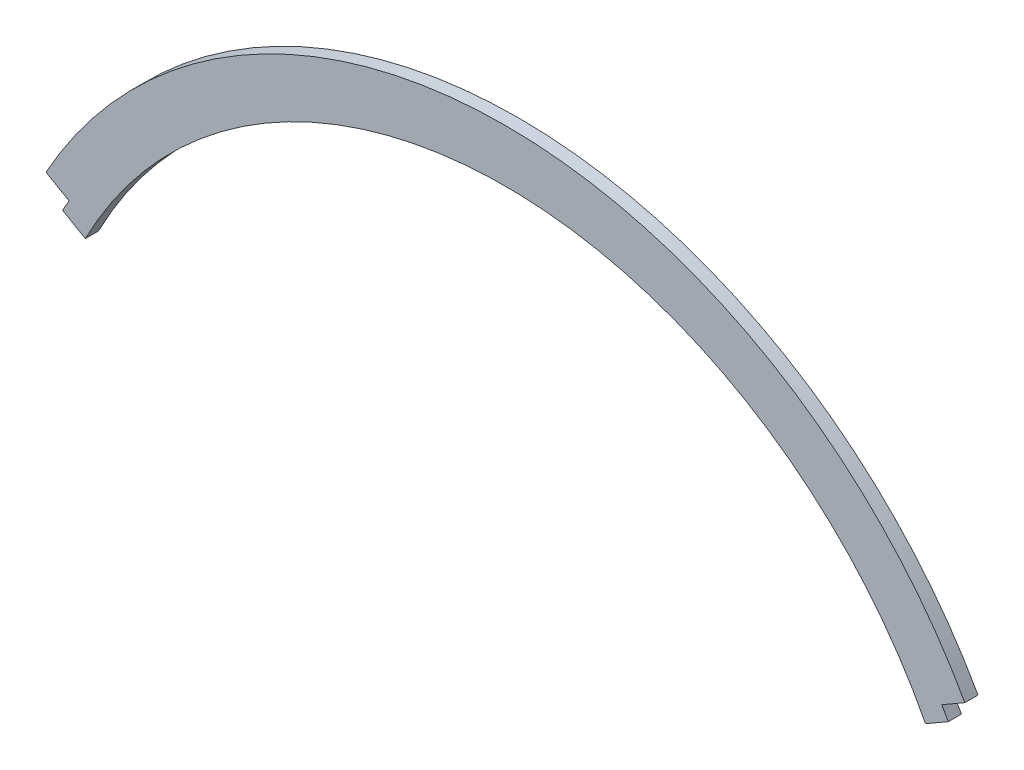
from build123d import *

# Parameters (mm, degrees)
BOSS_EXTRUDE1_DEPTH = 3.175
CUT_EXTRUDE1_DEPTH  = 135.915478092


with BuildPart() as part:
    # Sketch1 → Boss-Extrude1 (new body)
    with BuildSketch(Plane.XY):
        with BuildLine():
            Line((-101.484623167, 0), (-112.493407504, 6.355924601))
            ThreePointArc((-112.493407504, 6.355924601), (0, 74.413297682), (112.493407504, 6.355924601))
            Line((112.493407504, 6.355924601), (101.484623167, 0))
            ThreePointArc((101.484623167, 0), (0, 61.713297682), (-101.484623167, 0))
        make_face()
    extrude(amount=BOSS_EXTRUDE1_DEPTH)

    # Sketch2 → Cut-Extrude1 (cut, symmetric)
    with BuildSketch(Plane.XY.offset(3.175)):
        with BuildLine():
            Line((112.493407504, 6.355924601), (106.989015336, 3.1779623))
            Line((106.989015336, 3.1779623), (105.401515336, 5.927592957))
            Line((105.401515336, 5.927592957), (110.984177534, 9.15074448))
            ThreePointArc((110.984177534, 9.15074448), (111.747530211, 7.758052979), (112.493407504, 6.355924601))
        make_face()
    cut_extrude1 = extrude(amount=CUT_EXTRUDE1_DEPTH, both=True, mode=Mode.SUBTRACT)

    # Mirror1: Cut-Extrude1 across plane
    add(cut_extrude1.mirror(Plane(origin=(0, 0, 0), x_dir=(0, 0, 1), z_dir=(1, 0, 0))), mode=Mode.SUBTRACT)


solid = part.part
